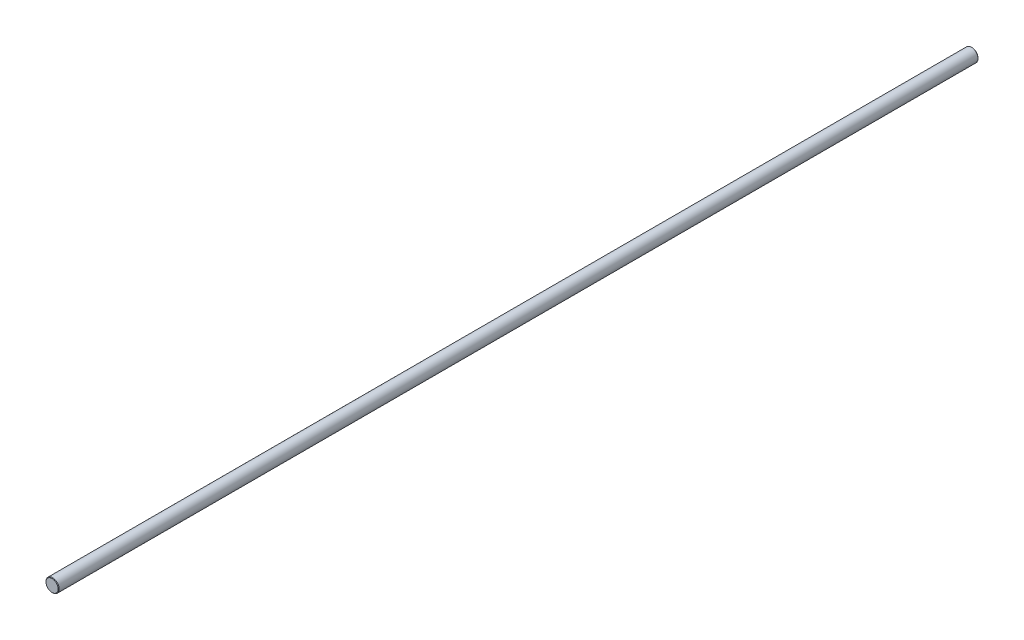
from build123d import *

# Parameters (mm, degrees)
SKETCH1_R           = 10
BOSS_EXTRUDE1_DEPTH = 698.5
CHAMFER1_SIZE       = 0.762


with BuildPart() as part:
    # Sketch1 → Boss-Extrude1 (new, symmetric)
    with BuildSketch(Plane.XY):
        Circle(SKETCH1_R)
    extrude(amount=BOSS_EXTRUDE1_DEPTH, both=True)

    # Chamfer1
    chamfer1_edges = [part.edges().sort_by_distance(p)[0] for p in [
        (-10, 0, -698.5),
        (-10, 0, 698.5),
    ]]
    chamfer(chamfer1_edges, length=CHAMFER1_SIZE)


solid = part.part
